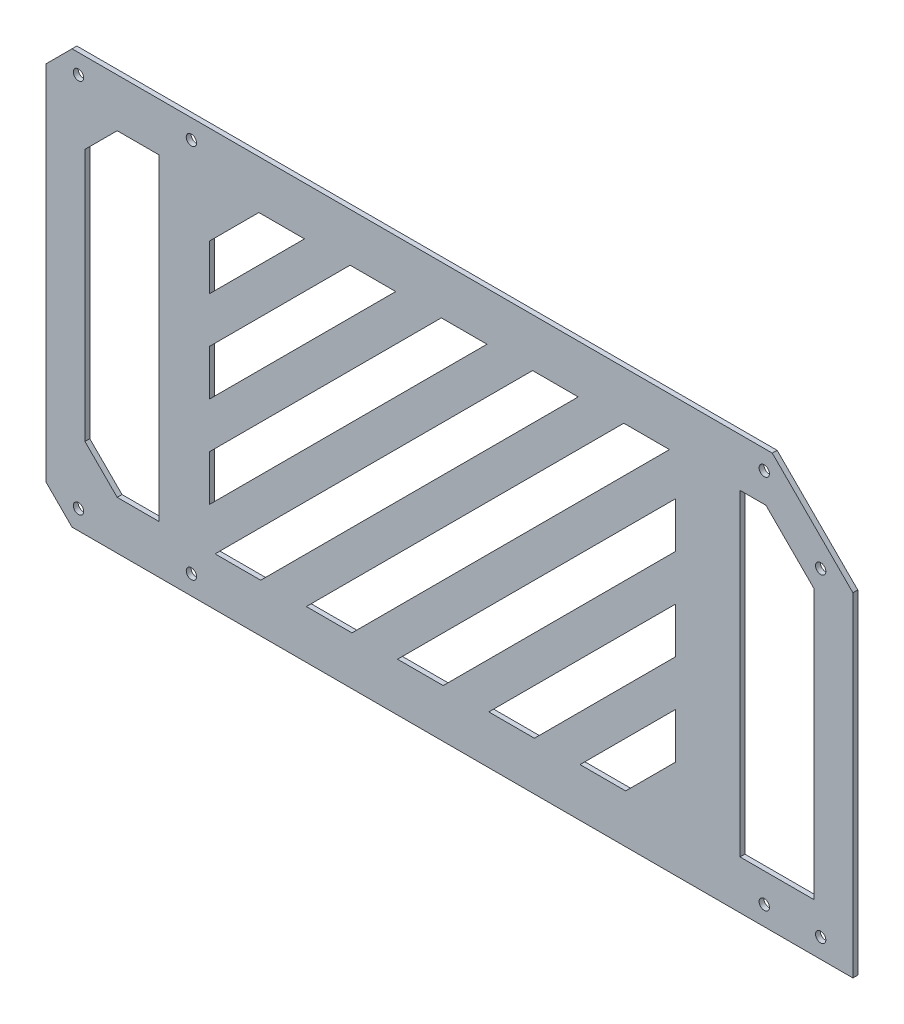
from build123d import *

# Parameters (mm, degrees)
BOSS_EXTRUDE1_DEPTH = 1.5
SKETCH5_R           = 1.6
CUT_EXTRUDE2_DEPTH  = 3.5
CUT_EXTRUDE4_DEPTH  = 10


with BuildPart() as part:
    # Sketch2 → Boss-Extrude1 (new body)
    with BuildSketch(Plane.XY):
        Polygon((803.47776474, 117.914742868), (586.414001465, 117.914742868), (578.414001465, 109.914742868), (578.414001465, -2.5), (586.414001465, -10.5), (828.47776474, -10.5), (828.47776474, 92.914742868), align=None)
        Polygon((613.414001465, 102.914742868), (613.414001465, 4.5), (600.414001465, 4.5), (590.414001465, 14.5), (590.414001465, 92.914742868), (600.414001465, 102.914742868), align=None, mode=Mode.SUBTRACT)
        Polygon((793.47776474, 4.5), (816.47776474, 4.5), (816.47776474, 87.94418012), (801.507201992, 102.914742868), (793.47776474, 102.914742868), align=None, mode=Mode.SUBTRACT)
    extrude(amount=BOSS_EXTRUDE1_DEPTH)

    # Sketch5 → Cut-Extrude2 (cut)
    with BuildSketch(Plane.XY.offset(1.5)):
        with Locations((588.414001465, 111.914742868)):
            Circle(SKETCH5_R)
        with Locations((588.414001465, -4.5)):
            Circle(SKETCH5_R)
        with Locations((818.47776474, -4.5)):
            Circle(SKETCH5_R)
        with Locations((623.414001465, 111.914742868)):
            Circle(SKETCH5_R)
        with Locations((623.414001465, -4.5)):
            Circle(SKETCH5_R)
        with Locations((800.992483366, 111.914742868)):
            Circle(SKETCH5_R)
        with Locations((818.47776474, 94.429461494)):
            Circle(SKETCH5_R)
        with Locations((800.992483366, -4.5)):
            Circle(SKETCH5_R)
    extrude(amount=-CUT_EXTRUDE2_DEPTH, mode=Mode.SUBTRACT)

    # Sketch6 → Cut-Extrude4 (cut)
    with BuildSketch(Plane.XY.offset(1.5)):
        Polygon((658.469461081, 102.914742868), (644.327325457, 102.914742868), (629.059768774, 87.647186185), (629.059768774, 73.505050562), align=None)
        Polygon((686.751596705, 102.914742868), (672.609461081, 102.914742868), (629.059768774, 59.365050562), (629.059768774, 45.222914938), align=None)
        Polygon((715.033732329, 102.914742868), (700.891596705, 102.914742868), (629.059768774, 31.082914938), (629.059768774, 16.940779314), align=None)
        Polygon((743.315867952, 102.914742868), (729.173732329, 102.914742868), (630.75898946, 4.5), (644.901125084, 4.5), align=None)
        Polygon((771.598003576, 102.914742868), (757.455867952, 102.914742868), (659.041125084, 4.5), (673.183260708, 4.5), align=None)
        Polygon((773.47776474, 76.512368409), (773.47776474, 90.654504032), (687.323260708, 4.5), (701.465396331, 4.5), align=None)
        Polygon((773.47776474, 48.230232785), (773.47776474, 62.372368409), (715.605396331, 4.5), (729.747531955, 4.5), align=None)
        Polygon((773.47776474, 19.948097161), (773.47776474, 34.090232785), (743.887531955, 4.5), (758.029667579, 4.5), align=None)
    extrude(amount=-CUT_EXTRUDE4_DEPTH, mode=Mode.SUBTRACT)


solid = part.part
